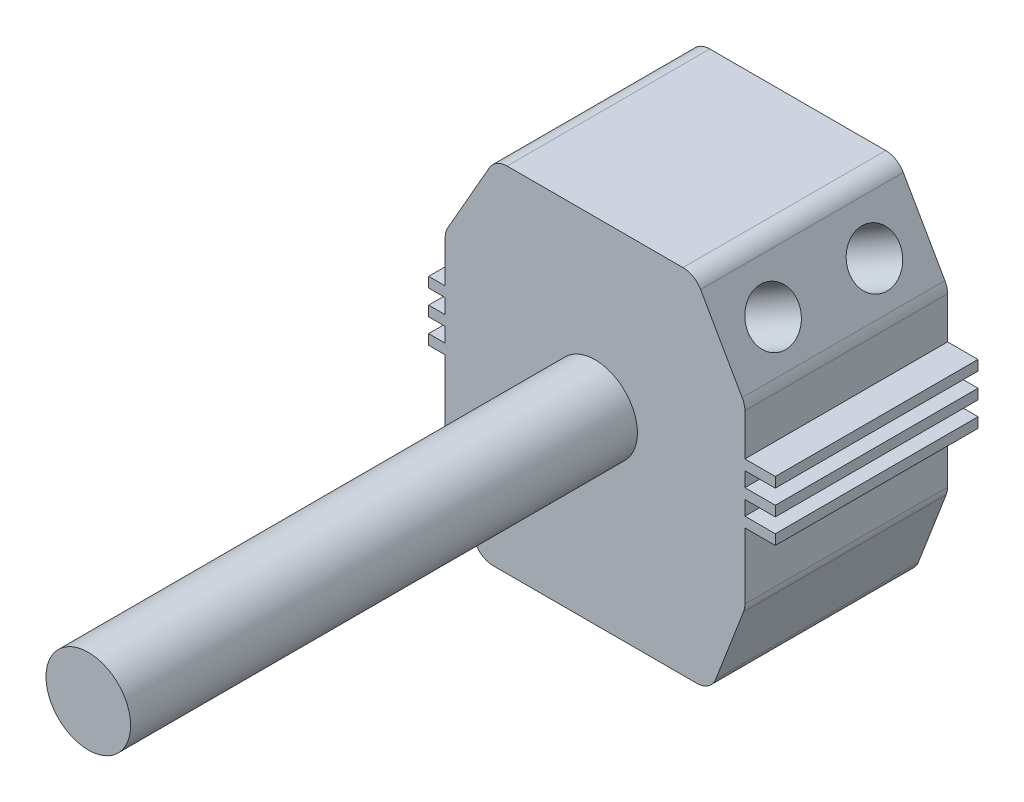
from build123d import *

# Parameters (mm, degrees)
BOSS_EXTRUDE1_DEPTH = 20
SKETCH2_R           = 4.175
BOSS_EXTRUDE2_DEPTH = 50
SKETCH3_R           = 2.5
CUT_EXTRUDE1_DEPTH  = 20
SKETCH4_R           = 2.5
CUT_EXTRUDE2_DEPTH  = 20
SKETCH5_W           = 20
SKETCH5_H           = 1
BOSS_EXTRUDE3_DEPTH = 3


with BuildPart() as part:
    # Sketch1 → Boss-Extrude1 (new body)
    with BuildSketch(Plane.XY):
        with BuildLine():
            Line((7.995487969, -56.473761751), (-9.363697209, -56.473761751))
            ThreePointArc((-9.363697209, -56.473761751), (-10.367550845, -56.743941564), (-11.100183493, -57.481483874))
            Line((-11.100183493, -57.481483874), (-15.206075193, -64.666794349))
            ThreePointArc((-15.206075193, -64.666794349), (-15.402588207, -65.145736355), (-15.469588909, -65.659072225))
            Line((-15.469588909, -65.659072225), (-15.469588909, -82.177343211))
            ThreePointArc((-15.469588909, -82.177343211), (-15.435979311, -82.54245797), (-15.336280121, -82.895301369))
            Line((-15.336280121, -82.895301369), (-12.59092286, -90.03323025))
            ThreePointArc((-12.59092286, -90.03323025), (-11.856504513, -90.963895201), (-10.724231647, -91.315272091))
            Line((-10.724231647, -91.315272091), (9.356022407, -91.315272091))
            ThreePointArc((9.356022407, -91.315272091), (10.488295272, -90.963895201), (11.22271362, -90.03323025))
            Line((11.22271362, -90.03323025), (13.968070881, -82.895301369))
            ThreePointArc((13.968070881, -82.895301369), (14.067770071, -82.54245797), (14.101379669, -82.177343211))
            Line((14.101379669, -82.177343211), (14.101379669, -65.659072225))
            ThreePointArc((14.101379669, -65.659072225), (14.034378966, -65.145736355), (13.837865953, -64.666794349))
            Line((13.837865953, -64.666794349), (9.731974253, -57.481483874))
            ThreePointArc((9.731974253, -57.481483874), (8.999341605, -56.743941564), (7.995487969, -56.473761751))
        make_face()
    extrude(amount=BOSS_EXTRUDE1_DEPTH)

    # Sketch2 → Boss-Extrude2 (add)
    with BuildSketch(Plane.XY.offset(20)):
        with Locations(Location((-0.677787665, -72.858920612, 0), (0, 0, 180))):
            Circle(SKETCH2_R)
    extrude(amount=BOSS_EXTRUDE2_DEPTH)

    # Sketch3 → Cut-Extrude1 (cut)
    with BuildSketch(Plane(origin=(-17.424843232, -9.957053275, 0), x_dir=(0, 0, -1), z_dir=(0.868243142124459, 0.4961389383568344, 0))):
        with Locations(Location((-15, -59.074401838, 0), (0, 0, 90))):
            Circle(SKETCH3_R)
        with Locations(Location((-5, -59.074401838, 0), (0, 0, 90))):
            Circle(SKETCH3_R)
    extrude(amount=-CUT_EXTRUDE1_DEPTH, mode=Mode.SUBTRACT)

    # Sketch4 → Cut-Extrude2 (cut)
    with BuildSketch(Plane(origin=(16.393423958, -9.367670833, 0), x_dir=(0, 0, 1), z_dir=(-0.8682431421244587, 0.4961389383568347, 0))):
        with Locations(Location((5, -59.480800533, 0), (0, 0, 270))):
            Circle(SKETCH4_R)
        with Locations(Location((15, -59.480800533, 0), (0, 0, 270))):
            Circle(SKETCH4_R)
    extrude(amount=-CUT_EXTRUDE2_DEPTH, mode=Mode.SUBTRACT)

    # Sketch5 → Boss-Extrude3 (add)
    with BuildSketch(Plane(origin=(14.101379669, 0, 0), x_dir=(0, 0, -1), z_dir=(1, 0, 0))):
        with Locations((-10, -70.26948122)):
            Rectangle(SKETCH5_W, SKETCH5_H)
        with Locations((-10, -72.728796036)):
            Rectangle(SKETCH5_W, SKETCH5_H)
        with Locations((-10, -75.163517703)):
            Rectangle(SKETCH5_W, SKETCH5_H)
    boss_extrude3 = extrude(amount=BOSS_EXTRUDE3_DEPTH)

    # Mirror1: Boss-Extrude3 across plane
    add(boss_extrude3.mirror(Plane(origin=(0, 0, 0), x_dir=(0, 0, 1), z_dir=(1, 0, 0))))


solid = part.part
